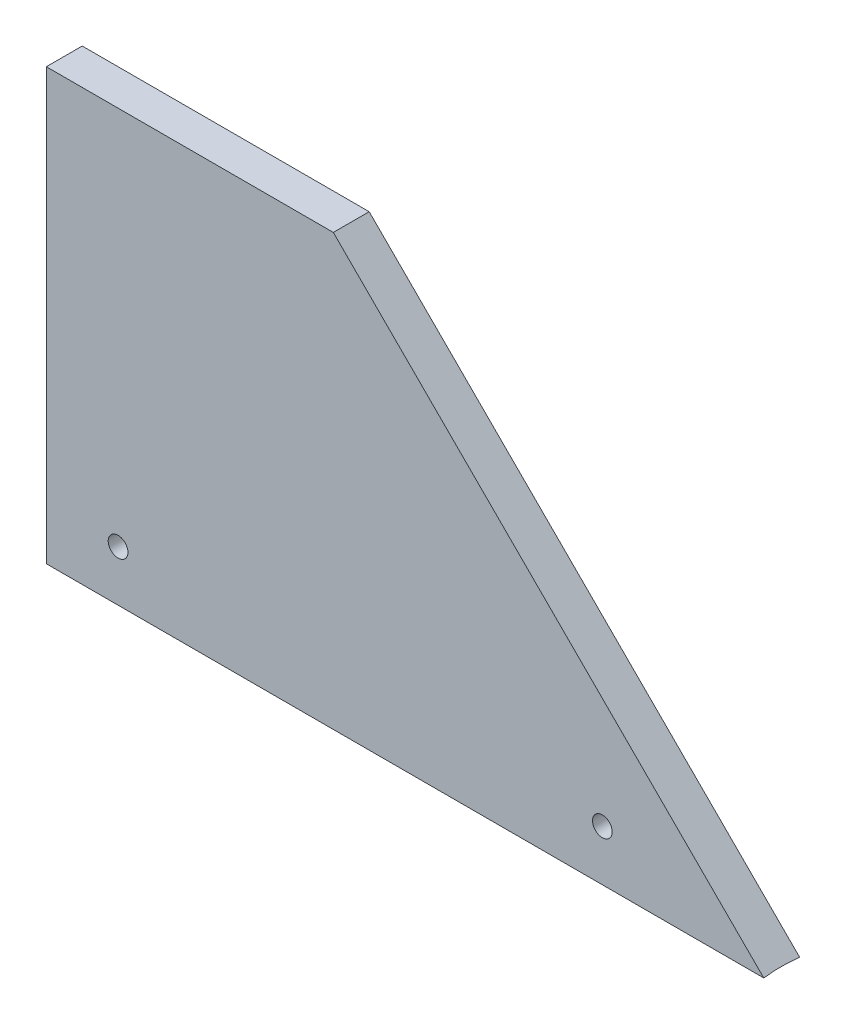
from build123d import *

# Parameters (mm, degrees)
BOSS_EXTRU_1_DEPTH           = 10
ENL_V_MAT_EXTRU_1_DEPTH      = 234.452350599
ENL_V_MAT_EXTRU_1_DEPTH_BACK = 234.452350599
D_GAGEMENT_M51_D             = 5.5


with BuildPart() as part:
    # Esquisse1 → Boss.-Extru.1 (new body)
    with BuildSketch(Plane.XY):
        Polygon((0, 0), (0, 120), (80, 120), (200, 0), align=None)
    extrude(amount=BOSS_EXTRU_1_DEPTH)

    # Esquisse2 → Enlèv. mat.-Extru.1 (cut, two sides: drawn at the far end of the back side and taken through both)
    with BuildSketch(Plane.ZY.offset(-ENL_V_MAT_EXTRU_1_DEPTH_BACK)):
        with BuildLine():
            Line((260.291322683, -16.458785536), (10, 0))
            ThreePointArc((10, 0), (5, 0.164218949), (0, 0))
            Line((0, 0), (-250.291322683, -16.458785536))
            Line((-250.291322683, -16.458785536), (-250.291322683, -518.122568688))
            Line((-250.291322683, -518.122568688), (260.291322683, -518.122568688))
            Line((260.291322683, -518.122568688), (260.291322683, -16.458785536))
        make_face()
    extrude(amount=ENL_V_MAT_EXTRU_1_DEPTH + ENL_V_MAT_EXTRU_1_DEPTH_BACK, mode=Mode.SUBTRACT)

    # Dégagement M51 (through all)
    with Locations(Plane.XY.offset(10)):
        with Locations((155, 14.123808081), (20, 14.123808081)):
            Hole(D_GAGEMENT_M51_D / 2)


solid = part.part
